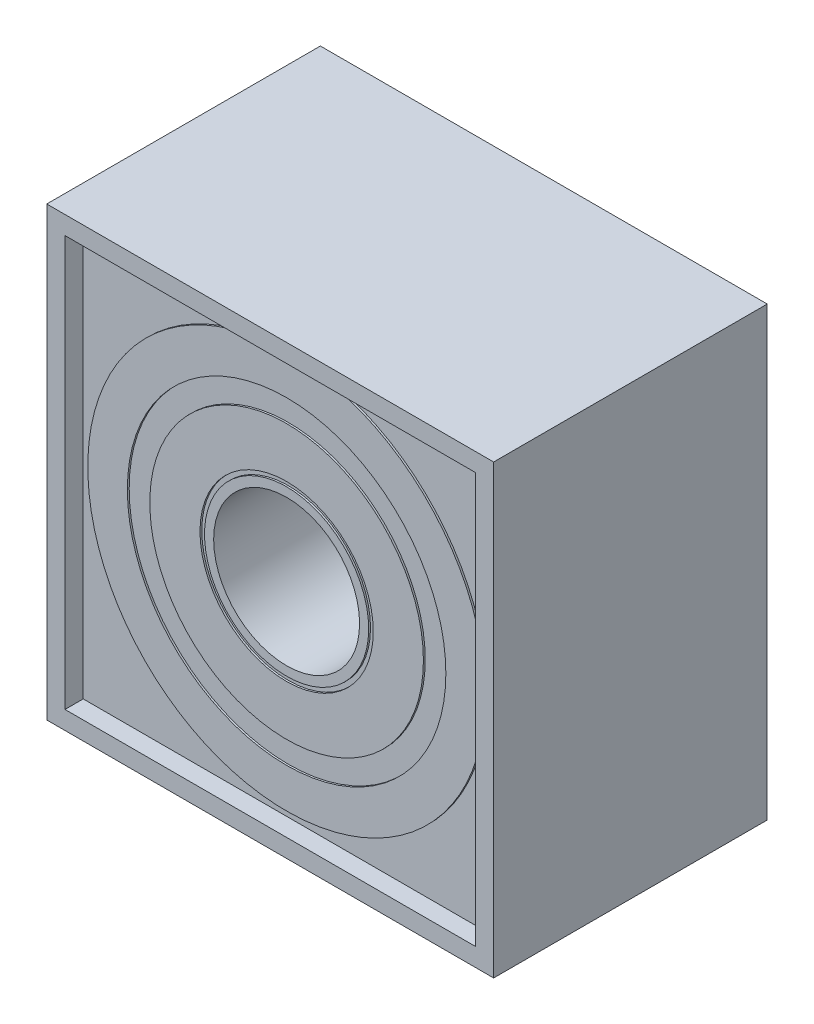
from build123d import *

# Parameters (mm, degrees)
SKETCH2_W                = 24.5
SKETCH2_H                = 24.5
SKETCH2_W_2              = 22.5
SKETCH2_H_2              = 22.5
BOSS_EXTRUDE1_DEPTH      = 15
SKETCH3_W                = 22.5
SKETCH3_H                = 22.5
BOSS_EXTRUDE2_DEPTH      = 14
BOSS_EXTRUDE4_DEPTH      = 0.1
BOSS_EXTRUDE4_DEPTH_BACK = 6.9
SKETCH4_R                = 10.9
SKETCH4_R_2              = 8.730342775
SKETCH4_R_3              = 7.5
SKETCH4_R_4              = 4.75
SKETCH4_R_5              = 4.5
SKETCH4_R_6              = 4
CUT_EXTRUDE1_START       = -15
SKETCH6_R                = 4
CUT_EXTRUDE1_DEPTH       = 15


with BuildPart() as part:
    # Sketch2 → Boss-Extrude1 (new body)
    with BuildSketch(Plane.XY):
        Rectangle(SKETCH2_W, SKETCH2_H)
        Rectangle(SKETCH2_W_2, SKETCH2_H_2, mode=Mode.SUBTRACT)
    extrude(amount=BOSS_EXTRUDE1_DEPTH)

    # Sketch3 → Boss-Extrude2 (add)
    with BuildSketch(Plane.XY):
        Rectangle(SKETCH3_W, SKETCH3_H)
    extrude(amount=BOSS_EXTRUDE2_DEPTH)

    # Sketch4 → Boss-Extrude4 (add, two sides: drawn at the far end of the back side and taken through both)
    # profile 1 of 3: a face of its own
    with BuildSketch(Plane.XY.offset(14).offset(-BOSS_EXTRUDE4_DEPTH_BACK)):
        Circle(SKETCH4_R)
        Circle(SKETCH4_R_2, mode=Mode.SUBTRACT)
    # profile 2 of 3: a face of its own
    with BuildSketch(Plane.XY.offset(14).offset(-BOSS_EXTRUDE4_DEPTH_BACK)):
        Circle(SKETCH4_R_3)
        Circle(SKETCH4_R_4, mode=Mode.SUBTRACT)
    # profile 3 of 3: a face of its own
    with BuildSketch(Plane.XY.offset(14).offset(-BOSS_EXTRUDE4_DEPTH_BACK)):
        Circle(SKETCH4_R_5)
        Circle(SKETCH4_R_6, mode=Mode.SUBTRACT)
    extrude(amount=BOSS_EXTRUDE4_DEPTH + BOSS_EXTRUDE4_DEPTH_BACK)

    # Sketch6 → Cut-Extrude1 (cut)
    with BuildSketch(Plane.XY.offset(14).offset(CUT_EXTRUDE1_START)):
        Circle(SKETCH6_R)
    extrude(amount=CUT_EXTRUDE1_DEPTH, mode=Mode.SUBTRACT)


solid = part.part
